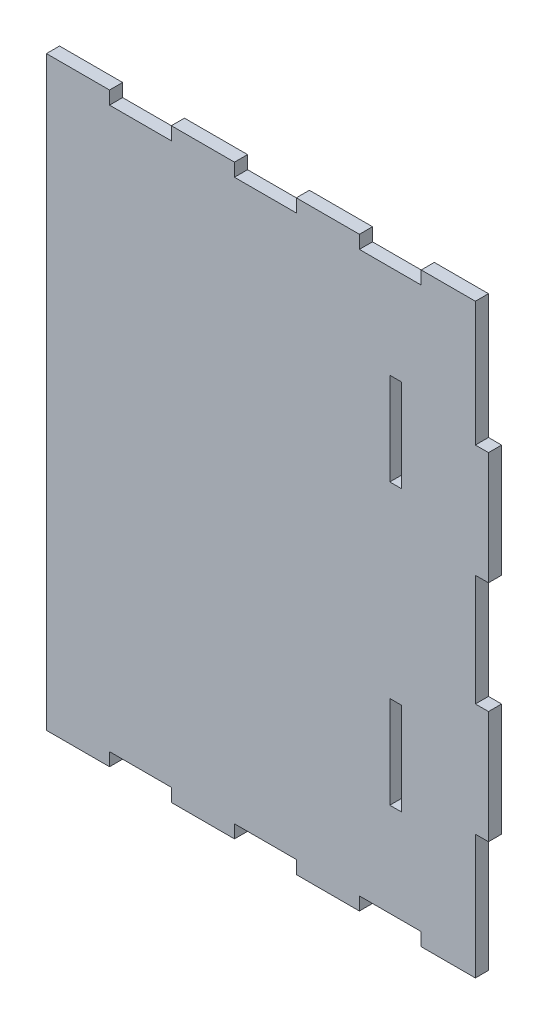
from build123d import *

# Parameters (mm, degrees)
SKETCH1_W           = 2.7
SKETCH1_H           = 21.173318662
BOSS_EXTRUDE1_DEPTH = 3


with BuildPart() as part:
    # Sketch1 → Boss-Extrude1 (new body)
    with BuildSketch(Plane.XY):
        Polygon((-26.565982448, -64.119955984), (-12.408839591, -64.119955984), (-12.408839591, -67.119955984), (0, -67.119955984), (0, -38.59197359), (3, -38.59197359), (3, -12.763991197), (0, -12.763991197), (0, 12.763991197), (3, 12.763991197), (3, 38.59197359), (0, 38.59197359), (0, 67.119955984), (-12.408839591, 67.119955984), (-12.408839591, 64.119955984), (-26.565982448, 64.119955984), (-26.565982448, 67.119955984), (-41.023125305, 67.119955984), (-41.023125305, 64.119955984), (-55.180268162, 64.119955984), (-55.180268162, 67.119955984), (-69.637411019, 67.119955984), (-69.637411019, 64.119955984), (-83.794553876, 64.119955984), (-83.794553876, 67.119955984), (-98.251696733, 67.119955984), (-98.251696733, -67.119955984), (-83.794553876, -67.119955984), (-83.794553876, -64.119955984), (-69.637411019, -64.119955984), (-69.637411019, -67.119955984), (-55.180268162, -67.119955984), (-55.180268162, -64.119955984), (-41.023125305, -64.119955984), (-41.023125305, -67.119955984), (-26.565982448, -67.119955984), align=None)
        with Locations((-18.251696733, 32.059977992)):
            Rectangle(SKETCH1_W, SKETCH1_H, mode=Mode.SUBTRACT)
        with Locations((-18.251696733, -32.059977992)):
            Rectangle(SKETCH1_W, SKETCH1_H, mode=Mode.SUBTRACT)
    extrude(amount=BOSS_EXTRUDE1_DEPTH)


solid = part.part
